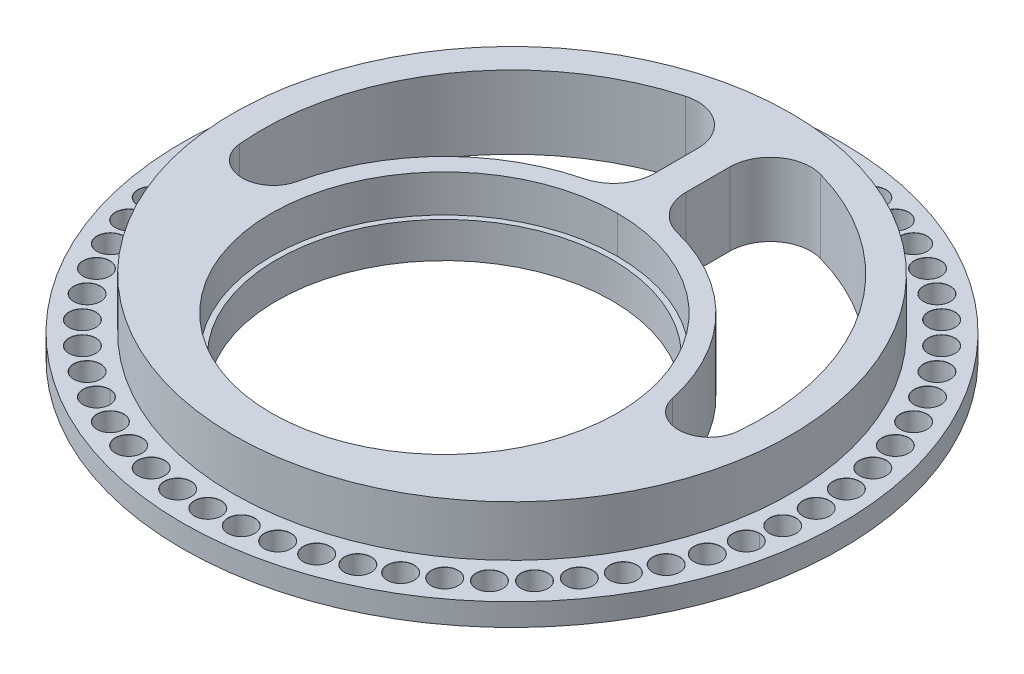
from build123d import *

# Parameters (mm, degrees)
SKETCH1_R                  = 61.9125
SKETCH1_R_2                = 30.988
SLOTTED_BODY_EXTRUDE_DEPTH = 4.191
SKETCH5_R                  = 52.3875
BOSS_EXTRUDE3_DEPTH        = 9.525
SKETCH6_R                  = 32.512
CUT_EXTRUDE5_DEPTH         = 89.62530095
SKETCH8_R                  = 32.512
SKETCH8_R_2                = 31.496
BOSS_EXTRUDE4_DEPTH        = 6.700000062
CIRPATTERN1_COUNT          = 60


with BuildPart() as part:
    # Sketch1 → Slotted-Body Extrude (new body)
    with BuildSketch(Plane(origin=(0, 0, 0), x_dir=(1, 0, 0), z_dir=(0, 1, 0))):
        with Locations(Location((0, 0, 0), (0, 0, 270))):
            Circle(SKETCH1_R)
        with Locations(Location((0, -12.7, 0), (0, 0, 270))):
            Circle(SKETCH1_R_2, mode=Mode.SUBTRACT)
    extrude(amount=SLOTTED_BODY_EXTRUDE_DEPTH)

    # Sketch5 → Boss-Extrude3 (add)
    with BuildSketch(Plane(origin=(0, 4.191, 0), x_dir=(1, 0, 0), z_dir=(0, 1, 0))):
        with Locations(Location((0, 0, 0), (0, 0, 90))):
            Circle(SKETCH5_R)
    extrude(amount=BOSS_EXTRUDE3_DEPTH)

    # Sketch6 → Cut-Extrude5 (cut, through all)
    with BuildSketch(Plane.XZ):
        with Locations(Location((0, 12.7, 0), (0, 0, 270))):
            Circle(SKETCH6_R)
        with BuildLine():
            Line((3.013951015, -37.906674687), (3.013951015, -29.674053734))
            ThreePointArc((3.013951015, -29.674053734), (4.62572071, -24.987309811), (8.779192117, -22.283230408))
            ThreePointArc((8.779192117, -22.283230408), (25.925135322, -12.375645206), (35.256203169, 5.09074497))
            ThreePointArc((35.256203169, 5.09074497), (41.313127715, 9.689980346), (46.782976949, 4.406037654))
            ThreePointArc((46.782976949, 4.406037654), (38.737451576, -26.59830719), (12.692135082, -45.243450433))
            ThreePointArc((12.692135082, -45.243450433), (6.03063496, -43.979061474), (3.013951015, -37.906674687))
        make_face()
        with BuildLine():
            Line((-3.013951015, -37.906674687), (-3.013951015, -29.674053734))
            ThreePointArc((-3.013951015, -29.674053734), (-4.62572071, -24.987309811), (-8.779192117, -22.283230408))
            ThreePointArc((-8.779192117, -22.283230408), (-25.925135322, -12.375645206), (-35.256203169, 5.09074497))
            ThreePointArc((-35.256203169, 5.09074497), (-41.313127715, 9.689980346), (-46.782976949, 4.406037654))
            ThreePointArc((-46.782976949, 4.406037654), (-38.737451576, -26.59830719), (-12.692135082, -45.243450433))
            ThreePointArc((-12.692135082, -45.243450433), (-6.03063496, -43.979061474), (-3.013951015, -37.906674687))
        make_face()
    extrude(amount=-CUT_EXTRUDE5_DEPTH, mode=Mode.SUBTRACT)

    # Sketch10 → Ø5.0mm Dowel Hole1 (revolve, cut)
    with BuildSketch(Plane(origin=(0, 4.191, -57.15), x_dir=(0, 0, 1), z_dir=(1, 0, 0))):
        Polygon((0, 0), (0, 4.191), (2.5, 4.191), (2.5, 0.025), (2.525, 0), align=None)
    f_5_0mm_dowel_hole1 = revolve(axis=Axis((0, 10.541, -57.15), (0, -1, 0)), mode=Mode.SUBTRACT)

    # CirPattern1: Ø5.0mm Dowel Hole1 ×60 about axis
    cirpattern1_axis = Axis((0, 0, 0), (0, 1, 0))
    for i in range(1, CIRPATTERN1_COUNT):
        add(f_5_0mm_dowel_hole1.rotate(cirpattern1_axis, i * 360 / CIRPATTERN1_COUNT), mode=Mode.SUBTRACT)


with BuildPart() as body_2:
    # Sketch8 → Boss-Extrude4 (new body)
    with BuildSketch(Plane.XZ):
        with Locations(Location((0, 12.7, 0), (0, 0, 270))):
            Circle(SKETCH8_R)
        with Locations(Location((0, 12.7, 0), (0, 0, 270))):
            Circle(SKETCH8_R_2, mode=Mode.SUBTRACT)
    extrude(amount=-BOSS_EXTRUDE4_DEPTH)


solid = Compound([part.part, body_2.part])
